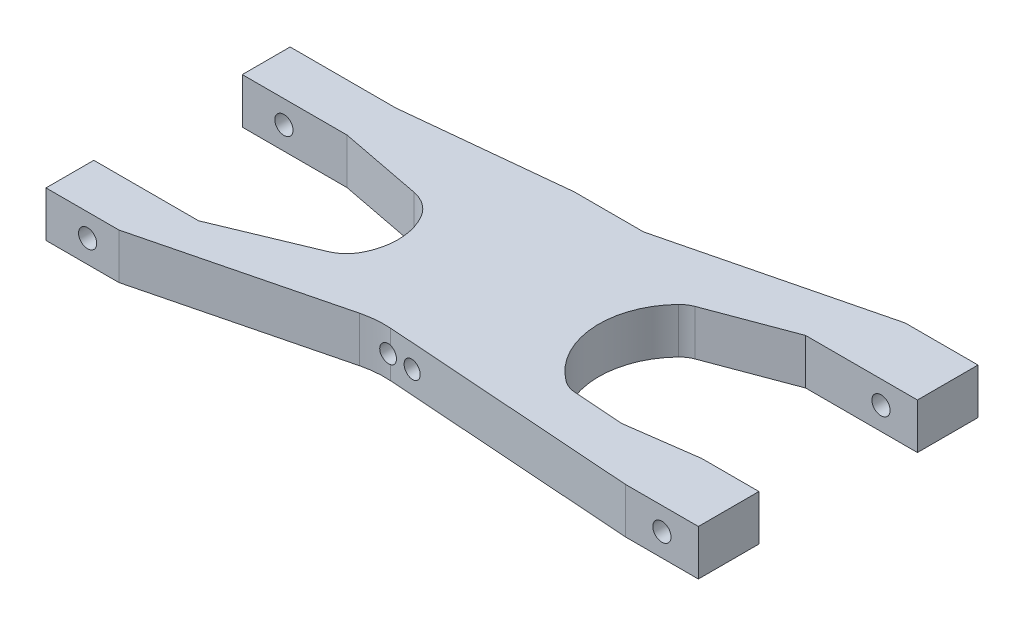
from build123d import *

# Parameters (mm, degrees)
BOSS_EXTRUDE1_DEPTH     = 6.35
CUT_EXTRUDE2_DEPTH      = 95.416035655
CUT_EXTRUDE2_DEPTH_BACK = 95.416035655
SKETCH2_R               = 1.27
CUT_EXTRUDE5_DEPTH      = 95.965858186
CUT_EXTRUDE7_DEPTH      = 25.4
SKETCH6_W               = 10.4785697
SKETCH6_H               = 6.35
SKETCH6_R               = 1.0795
BOSS_EXTRUDE2_DEPTH     = 12.7
FILLET5_R               = 12.7
FILLET6_R               = 5.08
BOSS_EXTRUDE3_DEPTH     = 6.35
SKETCH10_R              = 1.2065
CUT_EXTRUDE9_DEPTH      = 94.912222776
SKETCH12_W              = 15.691210344
SKETCH12_H              = 20.701
CUT_EXTRUDE10_DEPTH     = 95.965858193


with BuildPart() as part:
    # Sketch1 → Boss-Extrude1 (new body)
    with BuildSketch(Plane(origin=(0, 0, 0), x_dir=(1, 0, 0), z_dir=(0, 1, 0))):
        Polygon((0, 0), (0, 38.989), (-10.16, 38.989), (-71.628, 29.4386), (-86.36, 29.4386), (-86.36, -4.5974), (-76.2, -4.5974), (-10.16, 0), align=None)
    extrude(amount=BOSS_EXTRUDE1_DEPTH)

    # Sketch2 → Cut-Extrude2 (cut, two sides: drawn at the far end of the back side and taken through both)
    with BuildSketch(Plane(origin=(-0.604981675, 0, 0), x_dir=(-1, 0, 0), z_dir=(0, 0, -1)).offset(-CUT_EXTRUDE2_DEPTH_BACK)):
        with Locations((4.475018325, 3.175)):
            Circle(SKETCH2_R)
        with Locations(Location((79.949388362, 3.175, 0), (0, 0, 180))):
            Circle(SKETCH2_R)
    extrude(amount=CUT_EXTRUDE2_DEPTH + CUT_EXTRUDE2_DEPTH_BACK, mode=Mode.SUBTRACT)

    # Sketch3 → Cut-Extrude5 (cut, through all)
    with BuildSketch(Plane(origin=(0, 0, 0), x_dir=(1, 0, 0), z_dir=(0, 1, 0))):
        with BuildLine():
            Line((-81.915, 22.7711), (-71.755, 22.7711))
            Line((-71.755, 22.7711), (-58.487579402, 20.207642468))
            ThreePointArc((-58.487579402, 20.207642468), (-55.580114305, 14.192748547), (-57.777398298, 7.883687982))
            Line((-57.777398298, 7.883687982), (-71.755, 2.0701))
            Line((-71.755, 2.0701), (-81.915, 2.0701))
            Line((-81.915, 2.0701), (-81.915, 22.7711))
        make_face()
        with BuildLine():
            Line((0, 30.5435), (0, 8.4455))
            Line((0, 8.4455), (-7.9756, 8.4455))
            Line((-7.9756, 8.4455), (-17.739567161, 7.096263095))
            Line((-17.739567161, 7.096263095), (-24.764375431, 7.587485542))
            ThreePointArc((-24.764375431, 7.587485542), (-25.820245836, 7.814780317), (-26.769908004, 8.32923828))
            ThreePointArc((-26.769908004, 8.32923828), (-31.345543526, 16.545378703), (-28.210906636, 25.41191441))
            ThreePointArc((-28.210906636, 25.41191441), (-27.55579932, 25.957953915), (-26.795645997, 26.34459543))
            Line((-26.795645997, 26.34459543), (-15.585156538, 30.5435))
            Line((-15.585156538, 30.5435), (-7.9756, 30.5435))
            Line((-7.9756, 30.5435), (0, 30.5435))
        make_face()
    extrude(amount=CUT_EXTRUDE5_DEPTH, mode=Mode.SUBTRACT)

    # Sketch5 → Cut-Extrude7 (cut)
    with BuildSketch(Plane(origin=(0, 6.35, 0), x_dir=(1, 0, 0), z_dir=(0, 1, 0))):
        Polygon((-10.16, 38.989), (-53.78735915, 28.179846815), (-71.628, 29.4386), align=None)
        Polygon((-10.16, 0), (-47.394119509, 2.627067431), (-76.2, -4.5974), align=None)
    extrude(amount=-CUT_EXTRUDE7_DEPTH, mode=Mode.SUBTRACT)

    # Sketch6 → Boss-Extrude2 (add)
    with BuildSketch(Plane.XY.offset(-31.75)):
        with Locations((-43.810886798, 3.175)):
            Rectangle(SKETCH6_W, SKETCH6_H)
        with Locations((-45.72, 3.108706623)):
            Circle(SKETCH6_R, mode=Mode.SUBTRACT)
        with Locations((-42.164, 3.108706623)):
            Circle(SKETCH6_R, mode=Mode.SUBTRACT)
    extrude(amount=BOSS_EXTRUDE2_DEPTH)

    # Fillet5
    fillet5_edges = [part.edges().sort_by_distance(p)[0] for p in [
        (-47.394119509, 3.175, -2.627067431),
        (-53.78735915, 3.175, -28.179846815),
    ]]
    fillet(fillet5_edges, radius=FILLET5_R)

    # Fillet6
    fillet6_edges = [part.edges().sort_by_distance(p)[0] for p in [
        (-57.777398298, 3.175, -7.883687982),
        (-58.487579402, 3.175, -20.207642468),
    ]]
    fillet(fillet6_edges, radius=FILLET6_R)

    # Sketch9 → Boss-Extrude3 (add)
    with BuildSketch(Plane(origin=(0, 6.35, 0), x_dir=(1, 0, 0), z_dir=(0, 1, 0))):
        Polygon((-49.050171648, 31.75), (-71.628, 29.4386), (-71.628, 26.697361781), (-49.050171648, 26.697361781), align=None)
    extrude(amount=-BOSS_EXTRUDE3_DEPTH)

    # Sketch10 → Cut-Extrude9 (cut, through all)
    with BuildSketch(Plane(origin=(0, 0, -31.75), x_dir=(-1, 0, 0), z_dir=(0, 0, -1))):
        with Locations((42.164, 3.108706623)):
            Circle(SKETCH10_R)
        with Locations((45.72, 3.108706623)):
            Circle(SKETCH10_R)
    extrude(amount=-CUT_EXTRUDE9_DEPTH, mode=Mode.SUBTRACT)

    # Sketch12 → Cut-Extrude10 (cut, through all)
    with BuildSketch(Plane(origin=(0, 0, 0), x_dir=(1, 0, 0), z_dir=(0, 1, 0))):
        with Locations((-89.760605172, 12.4206)):
            Rectangle(SKETCH12_W, SKETCH12_H)
    extrude(amount=CUT_EXTRUDE10_DEPTH, mode=Mode.SUBTRACT)


solid = part.part
